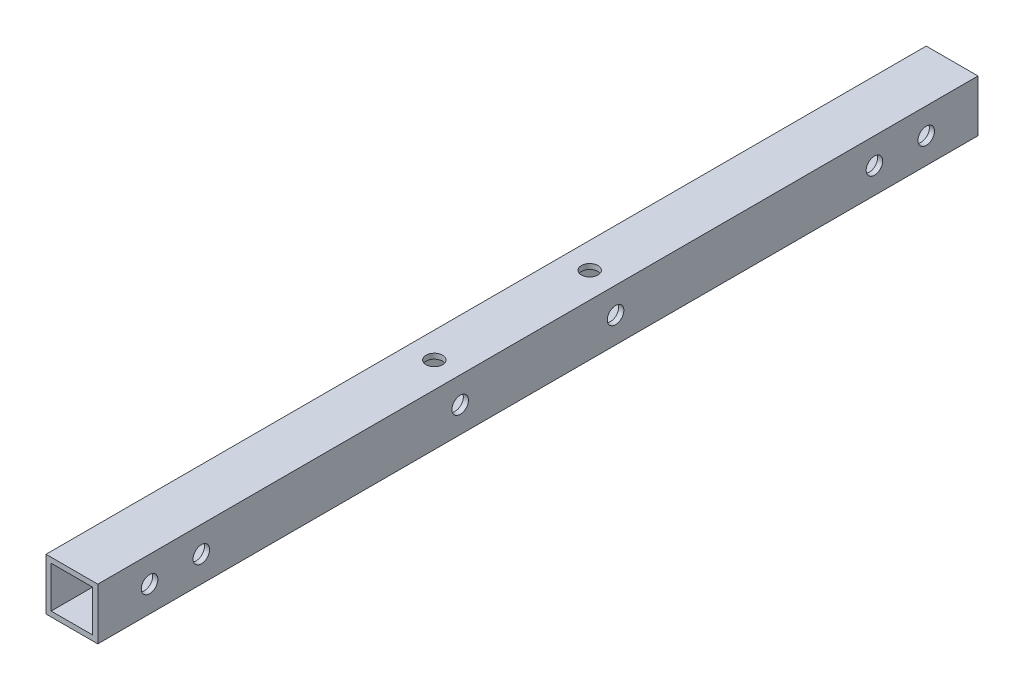
from build123d import *

# Parameters (mm, degrees)
SKETCH1_W           = 10
SKETCH1_H           = 10
SKETCH1_W_2         = 8
SKETCH1_H_2         = 8
BOSS_EXTRUDE1_DEPTH = 170
CUT_EXTRUDE1_REACH  = 172.367
SKETCH2_R           = 1.6
SKETCH3_R           = 1.6
CUT_EXTRUDE2_DEPTH  = 10


with BuildPart() as part:
    # Sketch1 → Boss-Extrude1 (new body)
    with BuildSketch(Plane.XY):
        Rectangle(SKETCH1_W, SKETCH1_H)
        Rectangle(SKETCH1_W_2, SKETCH1_H_2, mode=Mode.SUBTRACT)
    extrude(amount=BOSS_EXTRUDE1_DEPTH)

    # Cut-Extrude1: up to this face of the body (flat: up to its plane)
    cut_extrude1_end = Plane(part.part.faces().sort_by_distance((-5, 0, 85))[0])
    # Sketch2 → Cut-Extrude1 (cut, up to the picked face)
    with BuildSketch(Plane(origin=(5, 0, 0), x_dir=(0, 0, -1), z_dir=(1, 0, 0)), mode=Mode.PRIVATE) as cut_extrude1_sk1:
        with Locations(Location((-20, 0, 0), (0, 0, 90))):
            Circle(SKETCH2_R)
    cut_extrude1_tool1 = split(extrude(cut_extrude1_sk1.sketch, amount=-CUT_EXTRUDE1_REACH, mode=Mode.PRIVATE), bisect_by=cut_extrude1_end, keep=Keep.BOTH, mode=Mode.PRIVATE)
    # Sketch2 → Cut-Extrude1 (cut, up to the picked face)
    with BuildSketch(Plane(origin=(5, 0, 0), x_dir=(0, 0, -1), z_dir=(1, 0, 0)), mode=Mode.PRIVATE) as cut_extrude1_sk2:
        with Locations(Location((-10, 0, 0), (0, 0, 90))):
            Circle(SKETCH2_R)
    cut_extrude1_tool2 = split(extrude(cut_extrude1_sk2.sketch, amount=-CUT_EXTRUDE1_REACH, mode=Mode.PRIVATE), bisect_by=cut_extrude1_end, keep=Keep.BOTH, mode=Mode.PRIVATE)
    # Sketch2 → Cut-Extrude1 (cut, up to the picked face)
    with BuildSketch(Plane(origin=(5, 0, 0), x_dir=(0, 0, -1), z_dir=(1, 0, 0)), mode=Mode.PRIVATE) as cut_extrude1_sk3:
        with Locations(Location((-160, 0, 0), (0, 0, 90))):
            Circle(SKETCH2_R)
    cut_extrude1_tool3 = split(extrude(cut_extrude1_sk3.sketch, amount=-CUT_EXTRUDE1_REACH, mode=Mode.PRIVATE), bisect_by=cut_extrude1_end, keep=Keep.BOTH, mode=Mode.PRIVATE)
    # Sketch2 → Cut-Extrude1 (cut, up to the picked face)
    with BuildSketch(Plane(origin=(5, 0, 0), x_dir=(0, 0, -1), z_dir=(1, 0, 0)), mode=Mode.PRIVATE) as cut_extrude1_sk4:
        with Locations(Location((-150, 0, 0), (0, 0, 90))):
            Circle(SKETCH2_R)
    cut_extrude1_tool4 = split(extrude(cut_extrude1_sk4.sketch, amount=-CUT_EXTRUDE1_REACH, mode=Mode.PRIVATE), bisect_by=cut_extrude1_end, keep=Keep.BOTH, mode=Mode.PRIVATE)
    # Sketch2 → Cut-Extrude1 (cut, up to the picked face)
    with BuildSketch(Plane(origin=(5, 0, 0), x_dir=(0, 0, -1), z_dir=(1, 0, 0)), mode=Mode.PRIVATE) as cut_extrude1_sk5:
        with Locations(Location((-70, 0, 0), (0, 0, 90))):
            Circle(SKETCH2_R)
    cut_extrude1_tool5 = split(extrude(cut_extrude1_sk5.sketch, amount=-CUT_EXTRUDE1_REACH, mode=Mode.PRIVATE), bisect_by=cut_extrude1_end, keep=Keep.BOTH, mode=Mode.PRIVATE)
    # Sketch2 → Cut-Extrude1 (cut, up to the picked face)
    with BuildSketch(Plane(origin=(5, 0, 0), x_dir=(0, 0, -1), z_dir=(1, 0, 0)), mode=Mode.PRIVATE) as cut_extrude1_sk6:
        with Locations(Location((-100, 0, 0), (0, 0, 90))):
            Circle(SKETCH2_R)
    cut_extrude1_tool6 = split(extrude(cut_extrude1_sk6.sketch, amount=-CUT_EXTRUDE1_REACH, mode=Mode.PRIVATE), bisect_by=cut_extrude1_end, keep=Keep.BOTH, mode=Mode.PRIVATE)
    add(cut_extrude1_tool1.solids().sort_by(Axis((5, 0, 20), (-1, 0, 0)))[0], mode=Mode.SUBTRACT)
    add(cut_extrude1_tool2.solids().sort_by(Axis((5, 0, 10), (-1, 0, 0)))[0], mode=Mode.SUBTRACT)
    add(cut_extrude1_tool3.solids().sort_by(Axis((5, 0, 160), (-1, 0, 0)))[0], mode=Mode.SUBTRACT)
    add(cut_extrude1_tool4.solids().sort_by(Axis((5, 0, 150), (-1, 0, 0)))[0], mode=Mode.SUBTRACT)
    add(cut_extrude1_tool5.solids().sort_by(Axis((5, 0, 70), (-1, 0, 0)))[0], mode=Mode.SUBTRACT)
    add(cut_extrude1_tool6.solids().sort_by(Axis((5, 0, 100), (-1, 0, 0)))[0], mode=Mode.SUBTRACT)

    # Sketch3 → Cut-Extrude2 (cut)
    with BuildSketch(Plane(origin=(0, 5, 0), x_dir=(1, 0, 0), z_dir=(0, 1, 0))):
        with Locations(Location((0, -70, 0), (0, 0, 270))):
            Circle(SKETCH3_R)
        with Locations(Location((0, -100, 0), (0, 0, 270))):
            Circle(SKETCH3_R)
    extrude(amount=-CUT_EXTRUDE2_DEPTH, mode=Mode.SUBTRACT)


solid = part.part
